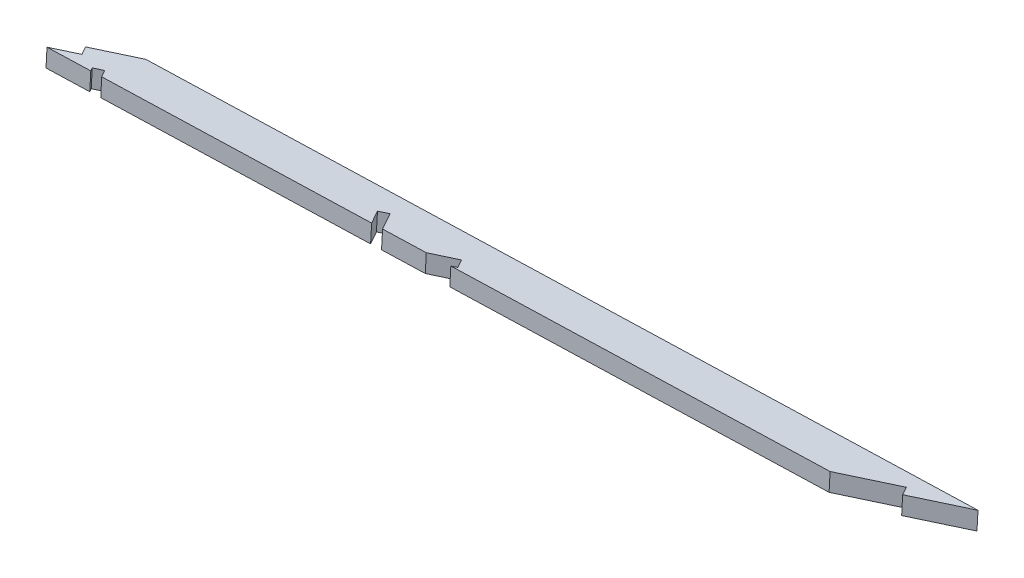
from build123d import *

# Parameters (mm, degrees)
BOSS_EXTRUDE2_DEPTH = 6.35


with BuildPart() as part:
    # Sketch2 → Boss-Extrude2 (new body)
    with BuildSketch(Plane(origin=(1.858094024, 36.591203, 26.227231961), x_dir=(0.9987103313600205, -0.05070190697545108, 0.002643986348489127), z_dir=(-0.05071293041421149, -0.9987040847793643, 0.004283658928477578))):
        Polygon((-496.323599349, -3.44349878), (-488.600030108, -7.724739312), (-490.139299605, -10.501657463), (-476.80980909, -17.889639796), (-213.220584146, -40.827895634), (-229.882439851, -31.592904325), (-231.421605069, -34.369880276), (-248.273629591, -25.029486098), (-368.414176113, -14.574526897), (-366.868118193, -15.431520034), (-368.40738769, -18.208438185), (-376.182758512, -13.898483593), (-390.035148211, -12.693010725), (-393.18415868, -18.373981046), (-395.961076831, -16.834711549), (-393.498245636, -12.391642508), (-478.994842442, -4.951494637), (-480.296729515, -7.300163178), (-483.073647665, -5.760893681), (-482.457939867, -4.65012642), align=None)
    extrude(amount=BOSS_EXTRUDE2_DEPTH)


solid = part.part
